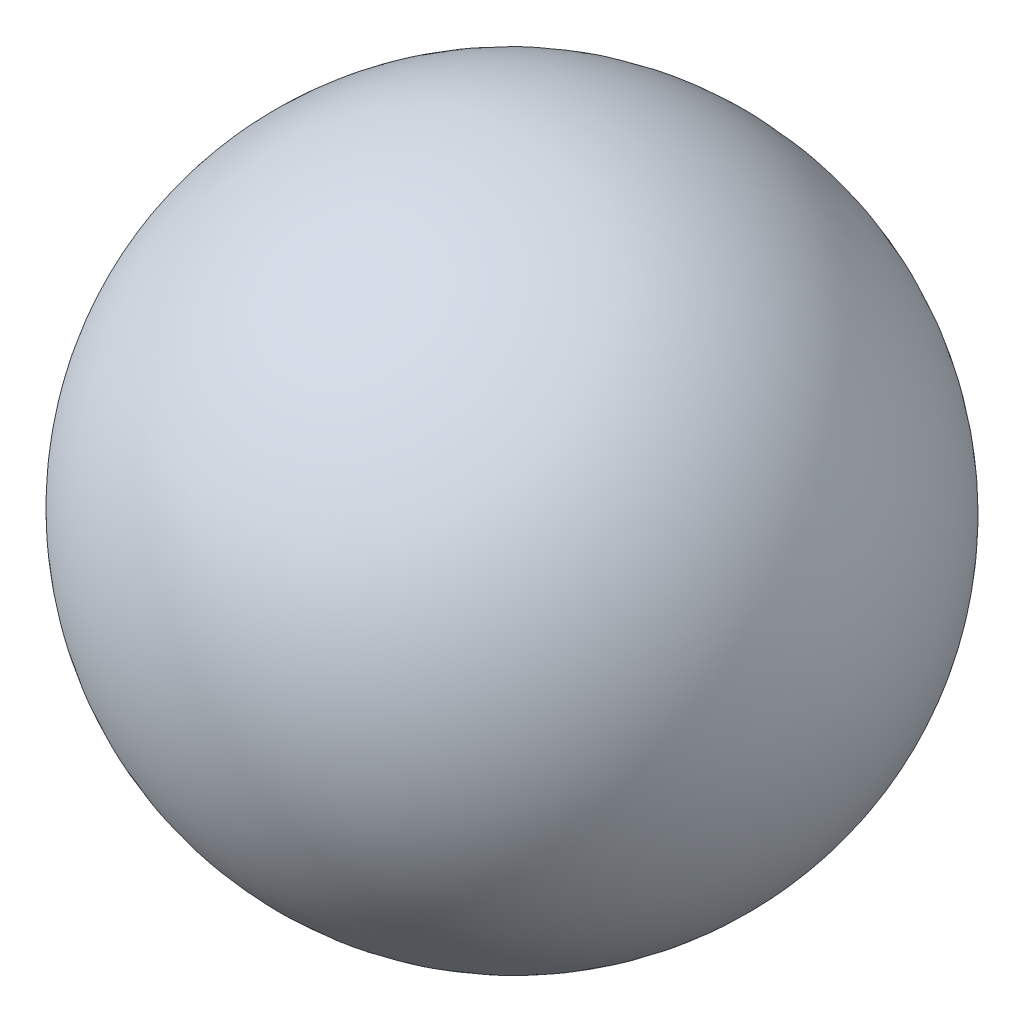
from build123d import *


with BuildPart() as part:
    # 草圖1 → 旋轉1 (revolve)
    with BuildSketch(Plane.XY):
        with BuildLine():
            Line((11.994962018, -0.347686904), (-11.999946738, -0.035753091))
            ThreePointArc((-11.999946738, -0.035753091), (-0.15598682, -11.998986129), (11.994962018, -0.347686904))
        make_face()
    revolve(axis=Axis((-14.750184475, 0, 0), (0.9999155107088669, -0.01299890163921521, 0)))


solid = part.part
